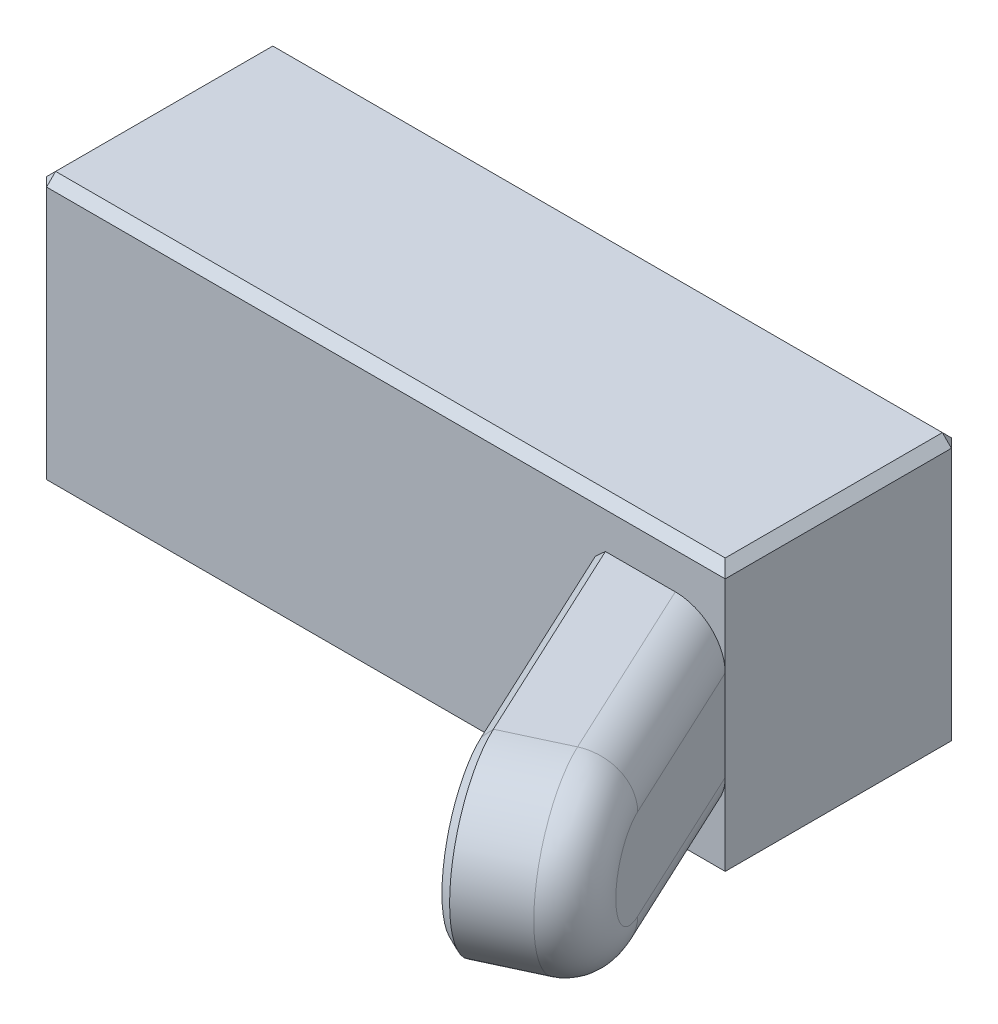
from build123d import *

# Parameters (mm, degrees)
BOSS_EXTRUDE1_DEPTH      = 15
BOSS_EXTRUDE1_DEPTH_BACK = 15
SKETCH1_W                = 76
SKETCH1_H                = 26
BOSS_EXTRUDE2_DEPTH      = 13
BOSS_EXTRUDE3_REACH      = 66.525
SKETCH4_W                = 13
SKETCH4_H                = 20
FILLET1_R                = 5
CHAMFER1_SIZE            = 1
SKETCH5_R                = 5
BOSS_EXTRUDE4_DEPTH      = 2


with BuildPart() as part:
    # Sketch1 → Boss-Extrude1 (new, two sides: drawn at the far end of the back side and taken through both)
    with BuildSketch(Plane(origin=(0, 0, 0), x_dir=(1, 0, 0), z_dir=(0, 1, 0)).offset(-BOSS_EXTRUDE1_DEPTH_BACK)):
        Rectangle(SKETCH1_W, SKETCH1_H)
    extrude(amount=BOSS_EXTRUDE1_DEPTH + BOSS_EXTRUDE1_DEPTH_BACK)

    # Sketch4 → Boss-Extrude3 (add, up to next)
    with BuildSketch(Plane(origin=(11.766324296, 0, 25.232963882), x_dir=(-0.9063077870366467, 0, 0.42261826174070655), z_dir=(-0.42261826174070655, 0, -0.9063077870366467)), mode=Mode.PRIVATE) as boss_extrude3_sk1:
        with Locations((-22.445658505, 0)):
            Rectangle(SKETCH4_W, SKETCH4_H)
    boss_extrude3_tool1 = extrude(boss_extrude3_sk1.sketch, amount=BOSS_EXTRUDE3_REACH, mode=Mode.PRIVATE) - part.part


with BuildPart() as body_2:
    # Sketch3 → Boss-Extrude2 (new body)
    with BuildSketch(Plane(origin=(26.233675704, 0, -12.232963882), x_dir=(0, 1, 0), z_dir=(-0.9063077870366467, 0, 0.4226182617407065))):
        with BuildLine():
            Line((-10, -27.841495178), (-10, -47.841495178))
            ThreePointArc((-10, -47.841495178), (0, -57.841495178), (10, -47.841495178))
            Line((10, -47.841495178), (10, -27.841495178))
            Line((10, -27.841495178), (-10, -27.841495178))
        make_face()
    extrude(amount=BOSS_EXTRUDE2_DEPTH)


with BuildPart() as part_1:
    add(part.part)

    add(body_2.part)  # Boss-Extrude3 merges body 2
    add(boss_extrude3_tool1.solids().sort_by_distance((32.108999, 0, 15.747019))[0])

    # Fillet1
    fillet1_edges = [part_1.edges().sort_by_distance(p)[0] for p in [
        (42.226182617, -10, 22.06307787),
        (50.678547852, 0, 40.189233611),
        (42.226182617, 10, 22.06307787),
    ]]
    fillet(fillet1_edges, radius=FILLET1_R)

    # Chamfer1
    chamfer1_edges = [part_1.edges().sort_by_distance(p)[0] for p in [
        (-38, 0, -13),
        (-38, 0, 13),
        (0, -15, 13),
        (38, -15, 0),
        (-38, -15, 0),
        (0, -15, -13),
        (0, 15, -13),
        (-38, 15, 0),
        (0, 15, 13),
        (38, 15, 0),
        (38, 0, -13),
        (29.163225528, -10, 24.810096572),
        (38.896546621, 0, 45.683271014),
        (29.163225528, 10, 24.810096572),
    ]]
    chamfer(chamfer1_edges, length=CHAMFER1_SIZE)

    # Sketch5 → Boss-Extrude4 (add)
    with BuildSketch(Plane.XZ.offset(15)):
        with Locations((-28, 0)):
            Circle(SKETCH5_R)
    extrude(amount=BOSS_EXTRUDE4_DEPTH)


solid = part_1.part
